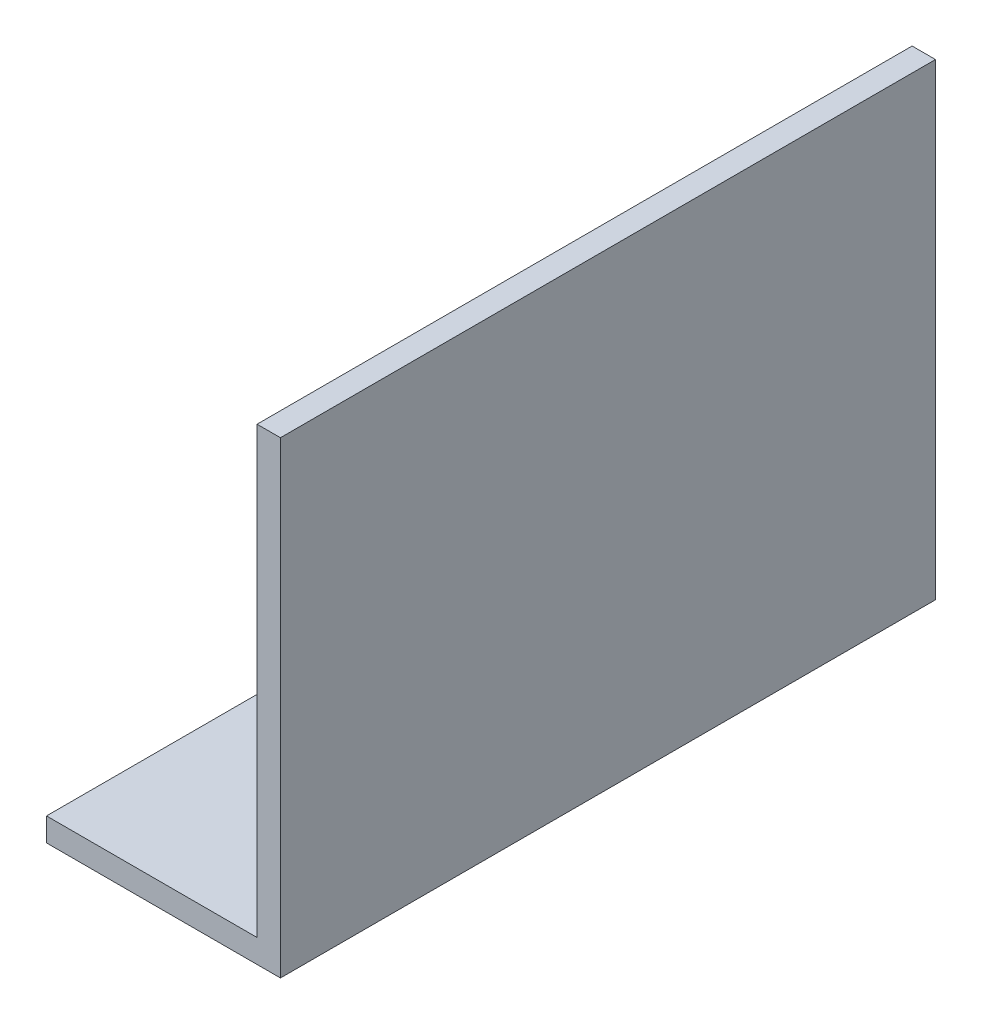
from build123d import *

# Parameters (mm, degrees)
BOSS_EXTRUDE1_DEPTH = 140


with BuildPart() as part:
    # Sketch1 → Boss-Extrude1 (new body)
    with BuildSketch(Plane.XY):
        Polygon((0, 0), (0, -100), (-50, -100), (-50, -95), (-5, -95), (-5, 0), align=None)
    extrude(amount=BOSS_EXTRUDE1_DEPTH)


solid = part.part
